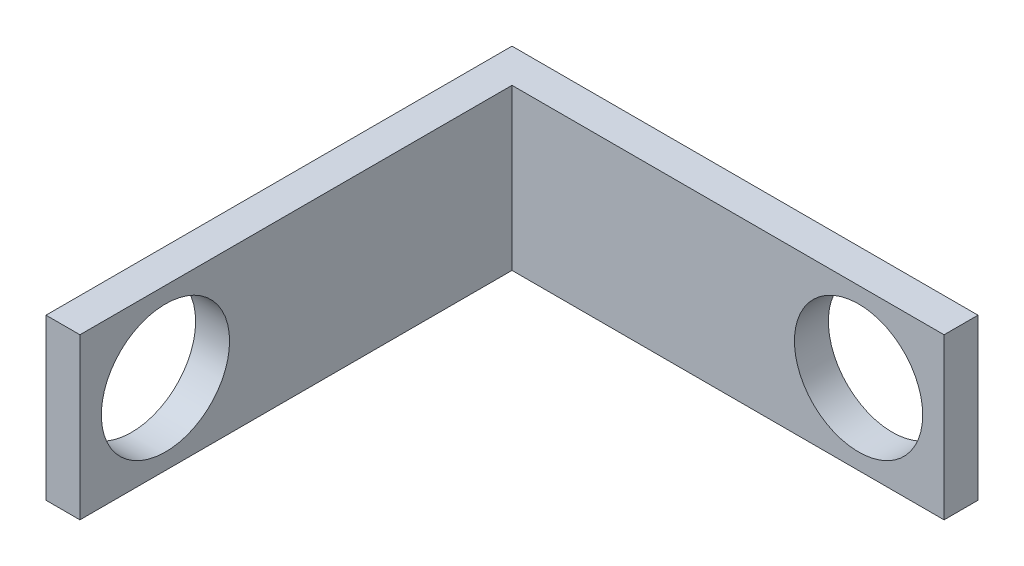
from build123d import *

# Parameters (mm, degrees)
BOSS_EXTRUDE1_DEPTH = 3.75
SKETCH2_R           = 3
CUT_EXTRUDE1_DEPTH  = 28.192786842
SKETCH3_R           = 3
CUT_EXTRUDE2_DEPTH  = 28.192786842


with BuildPart() as part:
    # Sketch1 → Boss-Extrude1 (new, symmetric)
    with BuildSketch(Plane(origin=(0, 0, 0), x_dir=(1, 0, 0), z_dir=(0, 1, 0))):
        Polygon((-4, 16.2125), (4, 16.2125), (4, 17.8), (-4, 17.8), (-17.8, 17.8), (-17.8, 4), (-17.8, -4), (-16.2125, -4), (-16.2125, 4), (-16.2125, 16.2125), align=None)
    extrude(amount=BOSS_EXTRUDE1_DEPTH, both=True)

    # Sketch2 → Cut-Extrude1 (cut, through all)
    with BuildSketch(Plane.XY.offset(-16.2125)):
        Circle(SKETCH2_R)
    extrude(amount=-CUT_EXTRUDE1_DEPTH, mode=Mode.SUBTRACT)

    # Sketch3 → Cut-Extrude2 (cut, through all)
    with BuildSketch(Plane(origin=(-16.2125, 0, 0), x_dir=(0, 0, -1), z_dir=(1, 0, 0))):
        Circle(SKETCH3_R)
    extrude(amount=-CUT_EXTRUDE2_DEPTH, mode=Mode.SUBTRACT)


solid = part.part
